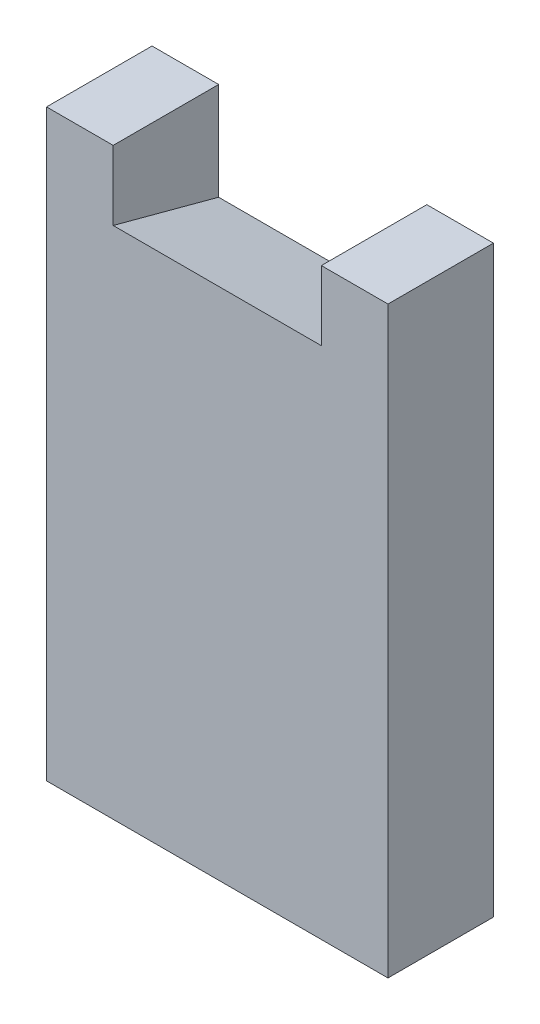
from build123d import *

# Parameters (mm, degrees)
EXTRUDE_1_DEPTH = 7.6
DRAFT_5_ANGLE   = -15


with BuildPart() as part:
    # 草图1 → 凸台-拉伸1 (new body)
    with BuildSketch(Plane.XY):
        Polygon((4.8, 0), (0, 0), (0, -42.055), (24.6, -42.055), (24.6, 0), (19.8, 0), (19.8, -5), (4.8, -5), align=None)
    extrude(amount=EXTRUDE_1_DEPTH)

    # 拔模5
    draft_5_faces = [part.faces().sort_by_distance(p)[0] for p in [
        (12.3, -5, 3.8),
    ]]
    draft(draft_5_faces, Plane.XY.offset(7.6), DRAFT_5_ANGLE)


solid = part.part
